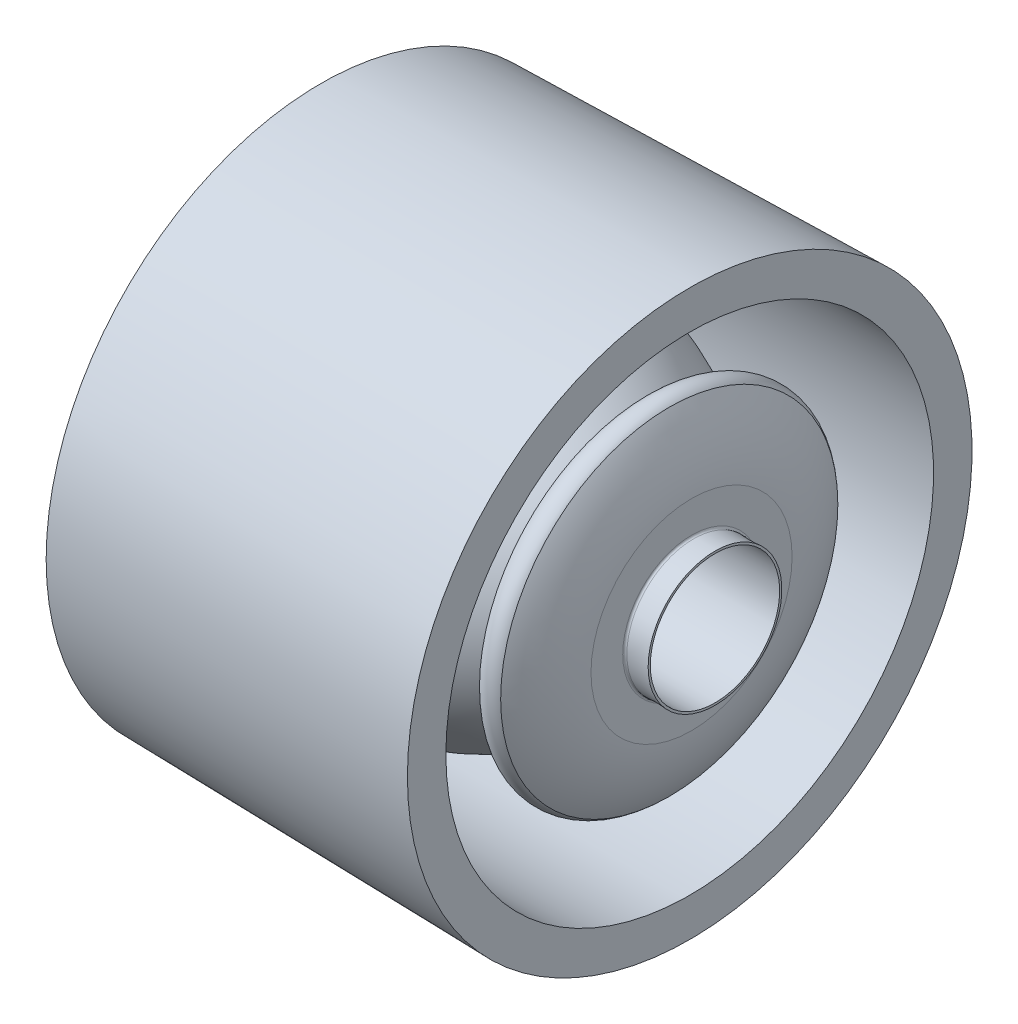
from build123d import *


with BuildPart() as part:
    # Sketch1 → Revolve14 (revolve)
    with BuildSketch(Plane.XY, mode=Mode.PRIVATE) as revolve14_sk:
        with BuildLine():
            ThreePointArc((38.650867659, 13.552705122), (39.703988191, 13.111091095), (40.764660937, 13.534244884))
            ThreePointArc((40.764660937, 13.534244884), (42.547871865, 17.29449042), (43.330039933, 21.381971408))
            Line((43.330039933, 21.381971408), (43.330039933, 25.3365))
            Line((43.330039933, 25.3365), (43.17780534, 25.3365))
            Line((43.17780534, 25.3365), (43.097253999, 25.231839758))
            ThreePointArc((43.097253999, 25.231839758), (29.037172994, 13.950323802), (11.365936374, 10.3886))
            Line((11.365936374, 10.3886), (11.365936374, 4.5212))
            Line((11.365936374, 4.5212), (43.369936374, 4.5212))
            Line((43.369936374, 4.5212), (43.369936374, 0))
            Line((43.369936374, 0), (0, 0.889))
            Line((0, 0.889), (0, 6.477))
            Line((0, 6.477), (10.414, 10.3886))
            Line((10.414, 10.3886), (10.414, 33.1978))
            Line((10.414, 33.1978), (10.718952979, 33.1978))
            Line((10.718952979, 33.1978), (10.718952979, 10.6426))
            Line((10.718952979, 10.6426), (11.370994965, 10.6426))
            ThreePointArc((11.370994965, 10.6426), (28.898518318, 14.165897296), (42.857219331, 25.3365))
            Line((42.857219331, 25.3365), (34.784736374, 25.3365))
            Line((34.784736374, 25.3365), (34.784736374, 25.5905))
            Line((34.784736374, 25.5905), (46.341736374, 25.5905))
            Line((46.341736374, 25.5905), (46.341736374, 25.3365))
            ThreePointArc((46.341736374, 25.3365), (45.079355578, 25.408427544), (43.815899343, 25.358857493))
            ThreePointArc((43.815899343, 25.358857493), (43.650770462, 25.277423096), (43.584039933, 25.105824305))
            Line((43.584039933, 25.105824305), (43.584039933, 21.3741))
            ThreePointArc((43.584039933, 21.3741), (42.78607195, 17.205705338), (40.963051574, 13.3731))
            ThreePointArc((40.963051574, 13.3731), (39.717157055, 12.857033593), (38.471262536, 13.3731))
            Line((38.471262536, 13.3731), (38.650867659, 13.552705122))
        make_face()
    revolve(revolve14_sk.sketch.rotate(Axis((10.414, 33.1978, 0), (1, 0, 0)), 270), axis=Axis((10.414, 33.1978, 0), (1, 0, 0)))


solid = part.part
